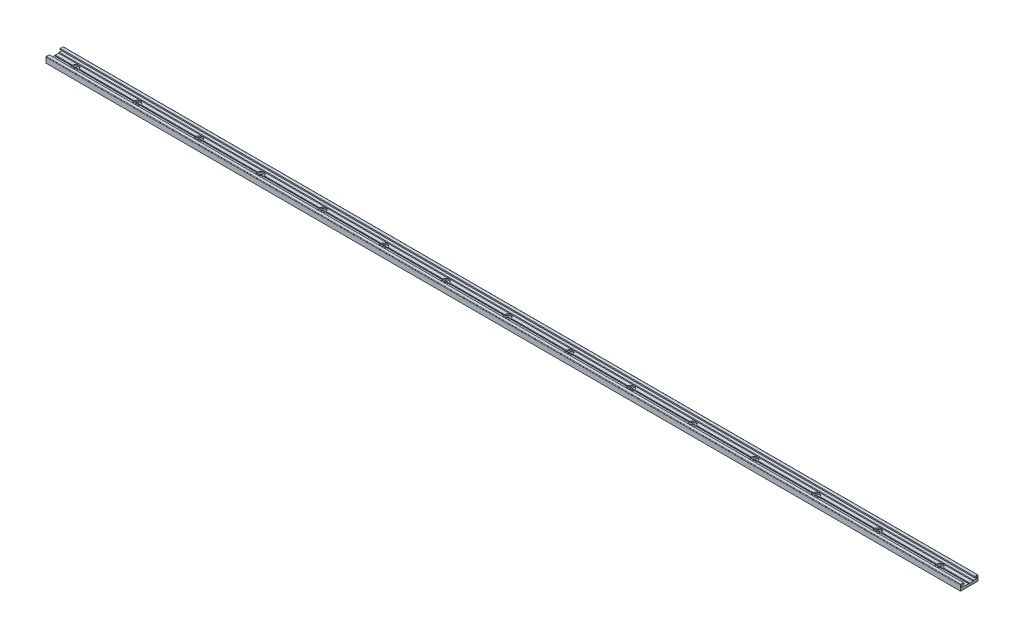
from build123d import *

# Parameters (mm, degrees)
BOSS_EXTRUDE1_DEPTH      = 500
BOSS_EXTRUDE1_DEPTH_BACK = 500
LPATTERN1_COUNT          = 17
LPATTERN1_PITCH          = 60
SKETCH6_W                = 111
SKETCH6_H                = 2.7
CUT_EXTRUDE1_DEPTH       = 501.102489496


with BuildPart() as part:
    # Sketch5 → Boss-Extrude1 (new, two sides: drawn at the far end of the back side and taken through both)
    with BuildSketch(Plane(origin=(0, 0, 0), x_dir=(0, 0, -1), z_dir=(1, 0, 0)).offset(-BOSS_EXTRUDE1_DEPTH_BACK)):
        with BuildLine():
            Line((-8.499999996, -2.75), (8.499999996, -2.75))
            Line((8.499999996, -2.75), (8.499999996, 2.25))
            ThreePointArc((8.499999996, 2.25), (8.353553387, 2.603553391), (7.999999996, 2.75))
            Line((7.999999996, 2.75), (5.299999996, 2.75))
            Line((5.299999996, 2.75), (5.299999996, 1.55))
            Line((5.299999996, 1.55), (7.299999998, 1.55))
            Line((7.299999998, 1.55), (7.299999998, 0.05))
            Line((7.299999998, 0.05), (4.249999998, 0.05))
            Line((4.249999998, 0.05), (3.749999998, -0.45))
            Line((3.749999998, -0.45), (0.499999998, -0.45))
            Line((0.499999998, -0.45), (0, -0.738675133))
            Line((0, -0.738675133), (-0.499999998, -0.45))
            Line((-0.499999998, -0.45), (-3.749999998, -0.45))
            Line((-3.749999998, -0.45), (-4.249999998, 0.05))
            Line((-4.249999998, 0.05), (-7.299999998, 0.05))
            Line((-7.299999998, 0.05), (-7.299999998, 1.55))
            Line((-7.299999998, 1.55), (-5.299999996, 1.55))
            Line((-5.299999996, 1.55), (-5.299999996, 2.75))
            Line((-5.299999996, 2.75), (-7.999999996, 2.75))
            ThreePointArc((-7.999999996, 2.75), (-8.353553387, 2.603553391), (-8.499999996, 2.25))
            Line((-8.499999996, 2.25), (-8.499999996, -2.75))
        make_face()
    extrude(amount=BOSS_EXTRUDE1_DEPTH + BOSS_EXTRUDE1_DEPTH_BACK)

    # Sketch3 → Cut-Revolve1 (revolve, cut)
    with BuildSketch(Plane.XY, mode=Mode.PRIVATE) as cut_revolve1_sk:
        Polygon((-483.25, -0.45), (-483.25, -1.75), (-481.75, -1.75), (-481.75, -2.75), (-480, -2.75), (-480, -0.45), align=None)
    cut_revolve1 = revolve(cut_revolve1_sk.sketch.rotate(Axis((-480, -2.75, 0), (0, 1, 0)), 180), axis=Axis((-480, -2.75, 0), (0, 1, 0)), mode=Mode.SUBTRACT)

    # LPattern1: Cut-Revolve1 ×17
    with Locations(*[(i * LPATTERN1_PITCH, 0, 0) for i in range(1, LPATTERN1_COUNT)]):
        add(cut_revolve1, mode=Mode.SUBTRACT)

    # Sketch6 → Cut-Extrude1 (cut, through all)
    with BuildSketch(Plane(origin=(0, 2.75, 0), x_dir=(1, 0, 0), z_dir=(0, 1, 0))):
        Polygon((389, 126.212542349), (389, 8.499999996), (389, 7.999999996), (500, 7.999999996), (500, 5.299999996), (389, 5.299999996), (389, -102.065679631), (557.848580128, -102.065679631), (557.848580128, 126.212542349), align=None)
        with Locations((444.5, 6.649999996)):
            Rectangle(SKETCH6_W, SKETCH6_H)
    extrude(amount=-CUT_EXTRUDE1_DEPTH, mode=Mode.SUBTRACT)


solid = part.part
